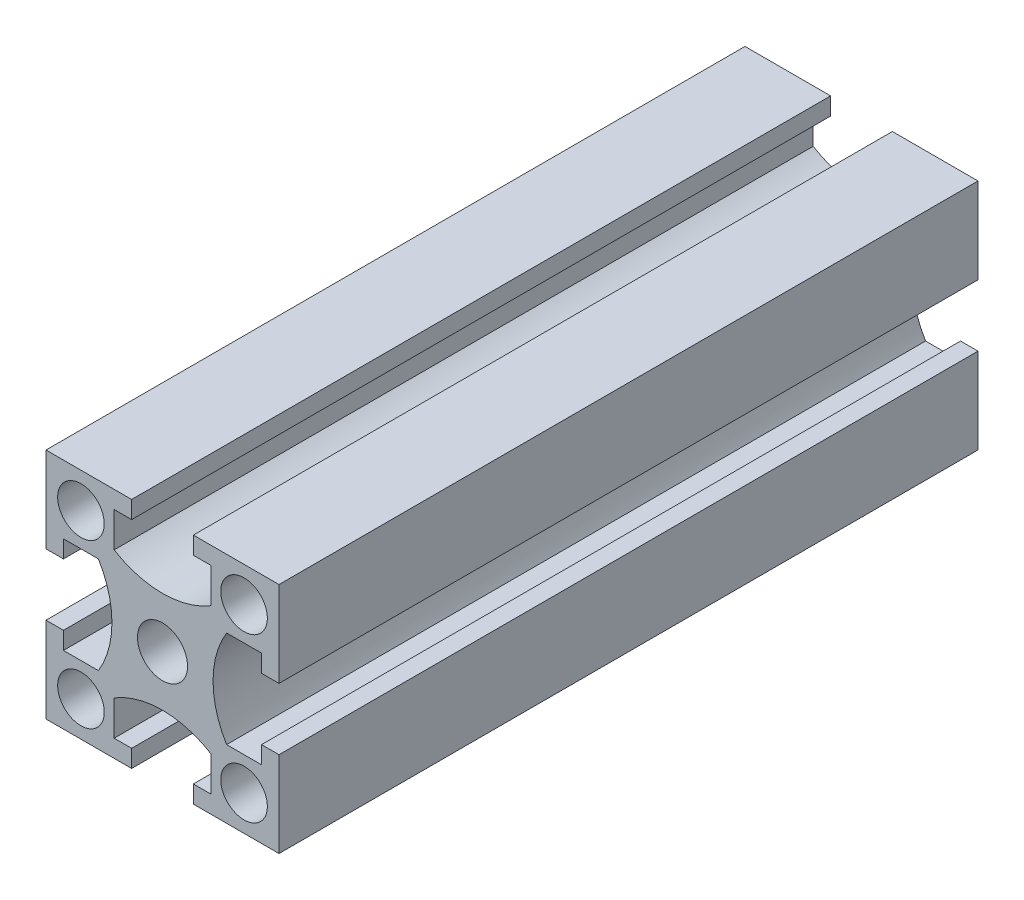
from build123d import *

# Parameters (mm, degrees)
SKETCH_1_W          = 20
SKETCH_1_H          = 20
EXTRUDE_1_DEPTH     = 60
SKETCH_2_R          = 2.15
SKETCH_2_R_2        = 2
CUT_EXTRUDE_1_DEPTH = 300


with BuildPart() as part:
    # 스케치1 → 보스-돌출1 (new body)
    with BuildSketch(Plane.XY):
        Rectangle(SKETCH_1_W, SKETCH_1_H)
    extrude(amount=EXTRUDE_1_DEPTH)

    # 스케치2 → 컷-돌출1 (cut)
    with BuildSketch(Plane.XY.offset(60)):
        Circle(SKETCH_2_R)
        with Locations((-7, 7)):
            Circle(SKETCH_2_R_2)
        with Locations((7, 7)):
            Circle(SKETCH_2_R_2)
        with Locations((7, -7)):
            Circle(SKETCH_2_R_2)
        with Locations((-7, -7)):
            Circle(SKETCH_2_R_2)
        with BuildLine():
            Line((-2.65, 10), (-2.65, 8.5))
            Line((-2.65, 8.5), (-4.15, 8.5))
            Line((-4.15, 8.5), (-4.15, 5.5))
            ThreePointArc((-4.15, 5.5), (0, 4.339407869), (4.15, 5.5))
            Line((4.15, 5.5), (4.15, 8.5))
            Line((4.15, 8.5), (2.65, 8.5))
            Line((2.65, 8.5), (2.65, 10))
            Line((2.65, 10), (-2.65, 10))
        make_face()
        with BuildLine():
            Line((10, 2.65), (8.5, 2.65))
            Line((8.5, 2.65), (8.5, 4.15))
            Line((8.5, 4.15), (5.5, 4.15))
            ThreePointArc((5.5, 4.15), (4.339407869, 0), (5.5, -4.15))
            Line((5.5, -4.15), (8.5, -4.15))
            Line((8.5, -4.15), (8.5, -2.65))
            Line((8.5, -2.65), (10, -2.65))
            Line((10, -2.65), (10, 2.65))
        make_face()
        with BuildLine():
            Line((2.65, -10), (2.65, -8.5))
            Line((2.65, -8.5), (4.15, -8.5))
            Line((4.15, -8.5), (4.15, -5.5))
            ThreePointArc((4.15, -5.5), (0, -4.339407869), (-4.15, -5.5))
            Line((-4.15, -5.5), (-4.15, -8.5))
            Line((-4.15, -8.5), (-2.65, -8.5))
            Line((-2.65, -8.5), (-2.65, -10))
            Line((-2.65, -10), (2.65, -10))
        make_face()
        with BuildLine():
            Line((-10, -2.65), (-8.5, -2.65))
            Line((-8.5, -2.65), (-8.5, -4.15))
            Line((-8.5, -4.15), (-5.5, -4.15))
            ThreePointArc((-5.5, -4.15), (-4.339407869, 0), (-5.5, 4.15))
            Line((-5.5, 4.15), (-8.5, 4.15))
            Line((-8.5, 4.15), (-8.5, 2.65))
            Line((-8.5, 2.65), (-10, 2.65))
            Line((-10, 2.65), (-10, -2.65))
        make_face()
    extrude(amount=-CUT_EXTRUDE_1_DEPTH, mode=Mode.SUBTRACT)


solid = part.part
